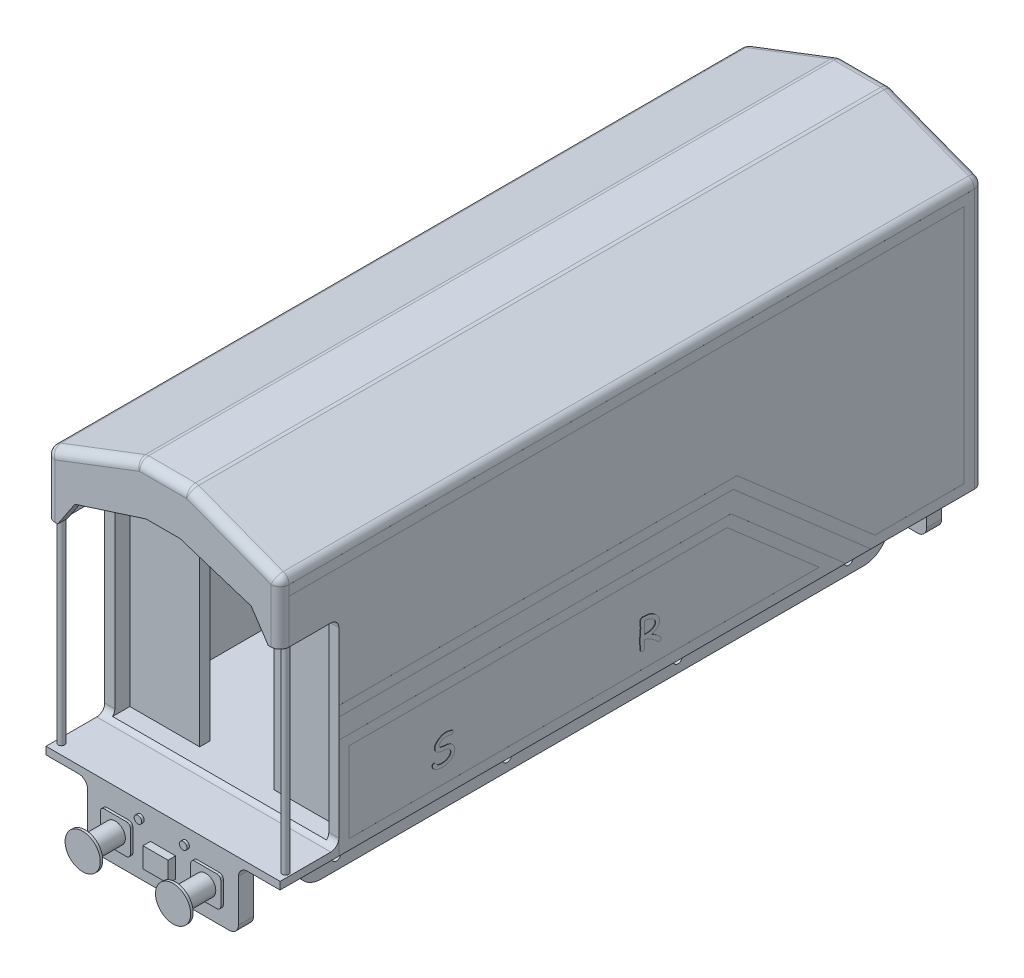
from build123d import *

# Parameters (mm, degrees)
BOSS_EXTRUDE1_DEPTH     = 14000
SHELL1_T                = 200
CUT_EXTRUDE1_DEPTH      = 3000
CUT_EXTRUDE2_REACH      = 15410.728
BOSS_EXTRUDE3_REACH     = 14774.911
SKETCH6_R               = 65
SKETCH8_W               = 3000
SKETCH8_H               = 300
BOSS_EXTRUDE4_DEPTH     = 1200
BOSS_EXTRUDE5_DEPTH     = 50
SKETCH10_R              = 200
BOSS_EXTRUDE6_DEPTH     = 500
SKETCH11_R              = 125
BOSS_EXTRUDE7_DEPTH     = 100
SKETCH12_R              = 350
BOSS_EXTRUDE8_DEPTH     = 50
SKETCH13_R              = 75
BOSS_EXTRUDE9_DEPTH     = 50
SKETCH14_W              = 500
SKETCH14_H              = 400
BOSS_EXTRUDE10_DEPTH    = 150
MIRROR4_COPY_1_DEPTH    = 50
MIRROR4_COPY_2_SKETCH_R = 200
MIRROR4_COPY_2_DEPTH    = 500
MIRROR4_COPY_3_SKETCH_R = 125
MIRROR4_COPY_3_DEPTH    = 100
MIRROR4_COPY_4_SKETCH_R = 350
MIRROR4_COPY_4_DEPTH    = 50
MIRROR4_COPY_5_SKETCH_R = 75
MIRROR4_COPY_5_DEPTH    = 50
SKETCH17_W              = 150
SKETCH17_H              = 11800
BOSS_EXTRUDE11_DEPTH    = 1000
FILLET1_R               = 500
CUT_EXTRUDE5_REACH      = 16346.553
SKETCH19_R              = 90
FILLET1_OF_MIRROR5_R    = 500
SKETCH20_W              = 200
SKETCH20_H              = 5300
BOSS_EXTRUDE12_DEPTH    = 1391
FILLET2_R               = 180
FILLET3_R               = 180
SKETCH22_W              = 4300
SKETCH22_H              = 10
EXTRUDE_THIN1_DEPTH     = 0.1
BOSS_EXTRUDE13_DEPTH    = 0.1
BOSS_EXTRUDE14_DEPTH    = 0.1
BOSS_EXTRUDE15_DEPTH    = 10
BOSS_EXTRUDE16_DEPTH    = 10


with BuildPart() as part:
    # Sketch1 → Boss-Extrude1 (new body)
    with BuildSketch(Plane.XY):
        Polygon((-2330, 0), (2330, 0), (2330, 5300), (500, 6000), (-500, 6000), (-2330, 5300), align=None)
    extrude(amount=BOSS_EXTRUDE1_DEPTH)

    # Shell1 (no face opened: a closed hollow body)
    add(offset(amount=-SHELL1_T, mode=Mode.PRIVATE), mode=Mode.SUBTRACT)

    # Sketch4 → Cut-Extrude1 (cut, symmetric)
    with BuildSketch(Plane(origin=(0, 0, 0), x_dir=(0, 0, -1), z_dir=(1, 0, 0))):
        with BuildLine():
            Line((-14390.42533688, 4100), (-12990.42533688, 4100))
            ThreePointArc((-12990.42533688, 4100), (-12877.28825189, 4053.13708499), (-12830.42533688, 3940))
            Line((-12830.42533688, 3940), (-12830.42533688, 310))
            ThreePointArc((-12830.42533688, 310), (-12877.28825189, 196.86291501), (-12990.42533688, 150))
            Line((-12990.42533688, 150), (-14390.42533688, 150))
            Line((-14390.42533688, 150), (-14390.42533688, 4100))
        make_face()
    extrude(amount=CUT_EXTRUDE1_DEPTH, both=True, mode=Mode.SUBTRACT)

    # Sketch5 → Cut-Extrude2 (cut, up to next)
    with BuildSketch(Plane.XY.offset(14000), mode=Mode.PRIVATE) as cut_extrude2_sk1:
        Polygon((-1755, 4609.835264861), (-337.194498934, 5065.001252609), (337.194498934, 5065.001252609), (1755, 4609.835264861), (2130, 4046.417851191), (-2130, 4046.417851191), align=None)
    cut_extrude2_tool1 = extrude(cut_extrude2_sk1.sketch, amount=-CUT_EXTRUDE2_REACH, mode=Mode.PRIVATE) & part.part
    add(cut_extrude2_tool1.solids().sort_by_distance((0, 4460.625012, 14000))[0], mode=Mode.SUBTRACT)

    # Sketch6 → Boss-Extrude3 (add, up to next)
    with BuildSketch(Plane.XZ.offset(-4100), mode=Mode.PRIVATE) as boss_extrude3_sk1:
        with Locations(Location((-2230, 13792.375141674, 0), (0, 0, 90))):
            Circle(SKETCH6_R)
    boss_extrude3_tool1 = extrude(boss_extrude3_sk1.sketch, amount=BOSS_EXTRUDE3_REACH, mode=Mode.PRIVATE) - part.part
    # Sketch6 → Boss-Extrude3 (add, up to next)
    with BuildSketch(Plane.XZ.offset(-4100), mode=Mode.PRIVATE) as boss_extrude3_sk2:
        with Locations(Location((2230, 13792.375141674, 0), (0, 0, 90))):
            Circle(SKETCH6_R)
    boss_extrude3_tool2 = extrude(boss_extrude3_sk2.sketch, amount=BOSS_EXTRUDE3_REACH, mode=Mode.PRIVATE) - part.part
    add(boss_extrude3_tool1.solids().sort_by_distance((-2230, 4100, 13792.375142))[0])
    add(boss_extrude3_tool2.solids().sort_by_distance((2230, 4100, 13792.375142))[0])

    # Sketch8 → Boss-Extrude4 (add)
    with BuildSketch(Plane(origin=(0, 0, 0), x_dir=(-1, 0, 0), z_dir=(0, -1, 0))):
        with Locations((0, -13850)):
            Rectangle(SKETCH8_W, SKETCH8_H)
    boss_extrude4 = extrude(amount=BOSS_EXTRUDE4_DEPTH)

    # Sketch9 → Boss-Extrude5 (add)
    with BuildSketch(Plane.XY.offset(14000)):
        with BuildLine():
            Line((1120, -300), (680, -300))
            ThreePointArc((680, -300), (623.431457505, -323.431457505), (600, -380))
            Line((600, -380), (600, -820))
            ThreePointArc((600, -820), (623.431457505, -876.568542495), (680, -900))
            Line((680, -900), (1120, -900))
            ThreePointArc((1120, -900), (1176.568542495, -876.568542495), (1200, -820))
            Line((1200, -820), (1200, -380))
            ThreePointArc((1200, -380), (1176.568542495, -323.431457505), (1120, -300))
        make_face()
    boss_extrude5 = extrude(amount=BOSS_EXTRUDE5_DEPTH)

    # Sketch10 → Boss-Extrude6 (add)
    with BuildSketch(Plane.XY.offset(14050)):
        with Locations((900, -600)):
            Circle(SKETCH10_R)
    boss_extrude6 = extrude(amount=BOSS_EXTRUDE6_DEPTH)

    # Sketch11 → Boss-Extrude7 (add)
    with BuildSketch(Plane.XY.offset(14550)):
        with Locations((900, -600)):
            Circle(SKETCH11_R)
    boss_extrude7 = extrude(amount=BOSS_EXTRUDE7_DEPTH)

    # Sketch12 → Boss-Extrude8 (add)
    with BuildSketch(Plane.XY.offset(14650)):
        with Locations((900, -600)):
            Circle(SKETCH12_R)
    boss_extrude8 = extrude(amount=BOSS_EXTRUDE8_DEPTH)

    # Mirror2: Boss-Extrude5, Boss-Extrude6, Boss-Extrude7, Boss-Extrude8 across plane
    add(boss_extrude5.mirror(Plane(origin=(0, 0, 0), x_dir=(0, 0, 1), z_dir=(1, 0, 0))))
    add(boss_extrude6.mirror(Plane(origin=(0, 0, 0), x_dir=(0, 0, 1), z_dir=(1, 0, 0))))
    add(boss_extrude7.mirror(Plane(origin=(0, 0, 0), x_dir=(0, 0, 1), z_dir=(1, 0, 0))))
    add(boss_extrude8.mirror(Plane(origin=(0, 0, 0), x_dir=(0, 0, 1), z_dir=(1, 0, 0))))

    # Sketch13 → Boss-Extrude9 (add)
    with BuildSketch(Plane.XY.offset(14000)):
        with Locations((-450, -150)):
            Circle(SKETCH13_R)
    boss_extrude9 = extrude(amount=BOSS_EXTRUDE9_DEPTH)

    # Mirror3: Boss-Extrude9 across plane
    add(boss_extrude9.mirror(Plane(origin=(0, 0, 0), x_dir=(0, 0, 1), z_dir=(1, 0, 0))))

    # Sketch14 → Boss-Extrude10 (add)
    with BuildSketch(Plane.XY.offset(14000)):
        with Locations((0, -650)):
            Rectangle(SKETCH14_W, SKETCH14_H)
    boss_extrude10 = extrude(amount=BOSS_EXTRUDE10_DEPTH)

    # Mirror4: Boss-Extrude4, Boss-Extrude5, Boss-Extrude6, Boss-Extrude7, Boss-Extrude8, Boss-Extrude9, Boss-Extrude10 across plane
    add(boss_extrude4.mirror(Plane(origin=(0, 0, 7000), x_dir=(1, 0, 0), z_dir=(0, 0, -1))))
    add(boss_extrude5.mirror(Plane(origin=(0, 0, 7000), x_dir=(1, 0, 0), z_dir=(0, 0, -1))))
    add(boss_extrude6.mirror(Plane(origin=(0, 0, 7000), x_dir=(1, 0, 0), z_dir=(0, 0, -1))))
    add(boss_extrude7.mirror(Plane(origin=(0, 0, 7000), x_dir=(1, 0, 0), z_dir=(0, 0, -1))))
    add(boss_extrude8.mirror(Plane(origin=(0, 0, 7000), x_dir=(1, 0, 0), z_dir=(0, 0, -1))))
    add(boss_extrude9.mirror(Plane(origin=(0, 0, 7000), x_dir=(1, 0, 0), z_dir=(0, 0, -1))))
    add(boss_extrude10.mirror(Plane(origin=(0, 0, 7000), x_dir=(1, 0, 0), z_dir=(0, 0, -1))))

    # Mirror4 copy 1 sketch → Mirror4 copy 1 (add)
    with BuildSketch(Plane(origin=(0, 0, 0), x_dir=(-1, 0, 0), z_dir=(0, 0, -1))):
        with BuildLine():
            Line((1120, -300), (680, -300))
            ThreePointArc((680, -300), (623.431457505, -323.431457505), (600, -380))
            Line((600, -380), (600, -820))
            ThreePointArc((600, -820), (623.431457505, -876.568542495), (680, -900))
            Line((680, -900), (1120, -900))
            ThreePointArc((1120, -900), (1176.568542495, -876.568542495), (1200, -820))
            Line((1200, -820), (1200, -380))
            ThreePointArc((1200, -380), (1176.568542495, -323.431457505), (1120, -300))
        make_face()
    extrude(amount=MIRROR4_COPY_1_DEPTH)

    # Mirror4 copy 2 sketch → Mirror4 copy 2 (add)
    with BuildSketch(Plane(origin=(0, 0, -50), x_dir=(-1, 0, 0), z_dir=(0, 0, -1))):
        with Locations((900, -600)):
            Circle(MIRROR4_COPY_2_SKETCH_R)
    extrude(amount=MIRROR4_COPY_2_DEPTH)

    # Mirror4 copy 3 sketch → Mirror4 copy 3 (add)
    with BuildSketch(Plane(origin=(0, 0, -550), x_dir=(-1, 0, 0), z_dir=(0, 0, -1))):
        with Locations((900, -600)):
            Circle(MIRROR4_COPY_3_SKETCH_R)
    extrude(amount=MIRROR4_COPY_3_DEPTH)

    # Mirror4 copy 4 sketch → Mirror4 copy 4 (add)
    with BuildSketch(Plane(origin=(0, 0, -650), x_dir=(-1, 0, 0), z_dir=(0, 0, -1))):
        with Locations((900, -600)):
            Circle(MIRROR4_COPY_4_SKETCH_R)
    extrude(amount=MIRROR4_COPY_4_DEPTH)

    # Mirror4 copy 5 sketch → Mirror4 copy 5 (add)
    with BuildSketch(Plane(origin=(0, 0, 0), x_dir=(-1, 0, 0), z_dir=(0, 0, -1))):
        with Locations((-450, -150)):
            Circle(MIRROR4_COPY_5_SKETCH_R)
    extrude(amount=MIRROR4_COPY_5_DEPTH)

    # Sketch17 → Boss-Extrude11 (add)
    with BuildSketch(Plane.XZ):
        with Locations((-1475, 7000)):
            Rectangle(SKETCH17_W, SKETCH17_H)
    boss_extrude11 = extrude(amount=BOSS_EXTRUDE11_DEPTH)

    # Fillet1
    fillet1_edges = [part.edges().sort_by_distance(p)[0] for p in [
        (-1475, -1000, 1100),
        (-1475, -1000, 12900),
    ]]
    fillet(fillet1_edges, radius=FILLET1_R)

    # Sketch19 → Cut-Extrude5 (cut, up to next)
    with BuildSketch(Plane.ZY.offset(1550), mode=Mode.PRIVATE) as cut_extrude5_sk1:
        with Locations((1900, -750)):
            Circle(SKETCH19_R)
    cut_extrude5_tool1 = extrude(cut_extrude5_sk1.sketch, amount=-CUT_EXTRUDE5_REACH, mode=Mode.PRIVATE) & part.part
    # Sketch19 → Cut-Extrude5 (cut, up to next)
    with BuildSketch(Plane.ZY.offset(1550), mode=Mode.PRIVATE) as cut_extrude5_sk2:
        with Locations((5300, -750)):
            Circle(SKETCH19_R)
    cut_extrude5_tool2 = extrude(cut_extrude5_sk2.sketch, amount=-CUT_EXTRUDE5_REACH, mode=Mode.PRIVATE) & part.part
    # Sketch19 → Cut-Extrude5 (cut, up to next)
    with BuildSketch(Plane.ZY.offset(1550), mode=Mode.PRIVATE) as cut_extrude5_sk3:
        with Locations((8700, -750)):
            Circle(SKETCH19_R)
    cut_extrude5_tool3 = extrude(cut_extrude5_sk3.sketch, amount=-CUT_EXTRUDE5_REACH, mode=Mode.PRIVATE) & part.part
    # Sketch19 → Cut-Extrude5 (cut, up to next)
    with BuildSketch(Plane.ZY.offset(1550), mode=Mode.PRIVATE) as cut_extrude5_sk4:
        with Locations((12100, -750)):
            Circle(SKETCH19_R)
    cut_extrude5_tool4 = extrude(cut_extrude5_sk4.sketch, amount=-CUT_EXTRUDE5_REACH, mode=Mode.PRIVATE) & part.part
    cut_extrude5_1 = cut_extrude5_tool1.solids().sort_by_distance((-1550, -750, 1900))[0]
    add(cut_extrude5_1, mode=Mode.SUBTRACT)
    cut_extrude5_2 = cut_extrude5_tool2.solids().sort_by_distance((-1550, -750, 5300))[0]
    add(cut_extrude5_2, mode=Mode.SUBTRACT)
    cut_extrude5_3 = cut_extrude5_tool3.solids().sort_by_distance((-1550, -750, 8700))[0]
    add(cut_extrude5_3, mode=Mode.SUBTRACT)
    cut_extrude5_4 = cut_extrude5_tool4.solids().sort_by_distance((-1550, -750, 12100))[0]
    add(cut_extrude5_4, mode=Mode.SUBTRACT)
    cut_extrude5 = cut_extrude5_1 + cut_extrude5_2 + cut_extrude5_3 + cut_extrude5_4  # Cut-Extrude5 as one shape, for the pattern or mirror that repeats it

    # Mirror5: Boss-Extrude11, Cut-Extrude5 across plane
    add(boss_extrude11.mirror(Plane(origin=(0, 0, 0), x_dir=(0, 0, 1), z_dir=(1, 0, 0))))
    add(cut_extrude5.mirror(Plane(origin=(0, 0, 0), x_dir=(0, 0, 1), z_dir=(1, 0, 0))), mode=Mode.SUBTRACT)

    # Fillet1 of Mirror5
    fillet1_of_mirror5_edges = [part.edges().sort_by_distance(p)[0] for p in [
        (1475, -1000, 1100),
        (1475, -1000, 12900),
    ]]
    fillet(fillet1_of_mirror5_edges, radius=FILLET1_OF_MIRROR5_R)

    # Sketch20 → Boss-Extrude12 (add)
    with BuildSketch(Plane.ZY.offset(-2130)):
        with Locations((12430.42533688, 2650)):
            Rectangle(SKETCH20_W, SKETCH20_H)
    boss_extrude12 = extrude(amount=BOSS_EXTRUDE12_DEPTH)

    # Mirror7: Boss-Extrude12 across plane
    add(boss_extrude12.mirror(Plane(origin=(0, 0, 0), x_dir=(0, 0, 1), z_dir=(1, 0, 0))))

    # Fillet2
    fillet2_edges = [part.edges().sort_by_distance(p)[0] for p in [
        (-1500, 0, 150),
        (1500, 0, 150),
        (1500, 0, 13850),
        (-1500, 0, 13850),
        (-1500, -1200, 13850),
        (1500, -1200, 13850),
        (1500, -1200, 150),
        (-1500, -1200, 150),
    ]]
    fillet(fillet2_edges, radius=FILLET2_R)

    # Fillet3
    fillet3_edges = [part.edges().sort_by_distance(p)[0] for p in [
        (-2330, 5300, 7000),
        (-500, 6000, 7000),
        (500, 6000, 7000),
        (2330, 5300, 7000),
        (1415, 5650, 14000),
        (0, 6000, 14000),
        (-1415, 5650, 14000),
        (2330, 4700, 14000),
        (-2330, 4700, 14000),
        (-1415, 5650, 0),
        (0, 6000, 0),
        (1415, 5650, 0),
        (2330, 2650, 0),
        (-2330, 2650, 0),
    ]]
    fillet(fillet3_edges, radius=FILLET3_R)

    # Sketch22 → Extrude-Thin1 (add)
    with BuildSketch(Plane(origin=(0, 0, 0), x_dir=(-1, 0, 0), z_dir=(0, 0, -1))):
        with Locations((0, 155)):
            Rectangle(SKETCH22_W, SKETCH22_H)
    extrude(amount=EXTRUDE_THIN1_DEPTH)

    # Sketch23 → Boss-Extrude13 (add)
    with BuildSketch(Plane(origin=(2330, 0, 0), x_dir=(0, 0, -1), z_dir=(1, 0, 0))):
        Polygon((-380, 4976.133334089), (-13620, 4976.133334089), (-13820, 4976.133334089), (-13820, 5176.133334089), (-180, 5176.133334089), (-180, 0), (-2237.013164663, 0), (-4977.742745599, 2397.302348445), (-12830.42533688, 2397.302348445), (-12830.42533688, 2597.302348445), (-12630.42533688, 2597.302348445), (-4902.615440442, 2597.302348445), (-2161.885859505, 200), (-380, 200), align=None)
    boss_extrude13 = extrude(amount=BOSS_EXTRUDE13_DEPTH)

    # Sketch25 → Boss-Extrude14 (add)
    with BuildSketch(Plane(origin=(2330, 0, 0), x_dir=(0, 0, -1), z_dir=(1, 0, 0))):
        Polygon((-12830.42533688, 310), (-12830.42533688, 0), (-2737.608532027, 0), (-5024.119937411, 2000), (-12830.42533688, 2000), align=None)
        Polygon((-12630.42533688, 310), (-12630.42533688, 200), (-3270.038118261, 200), (-5099.247242569, 1800), (-12630.42533688, 1800), align=None, mode=Mode.SUBTRACT)
    boss_extrude14 = extrude(amount=BOSS_EXTRUDE14_DEPTH)

    # Mirror8: Boss-Extrude13, Boss-Extrude14 across plane
    add(boss_extrude13.mirror(Plane(origin=(0, 0, 0), x_dir=(0, 0, 1), z_dir=(1, 0, 0))))
    add(boss_extrude14.mirror(Plane(origin=(0, 0, 0), x_dir=(0, 0, 1), z_dir=(1, 0, 0))))

    # Sketch26 → Boss-Extrude15 (add)
    # profile 1 of 2: a face of its own
    with BuildSketch(Plane(origin=(2330, 0, 0), x_dir=(0, 0, -1), z_dir=(1, 0, 0))):
        with BuildLine():
            add(Edge.make_bspline(
                [(-10976.652245452, 623.49716014), (-10976.582564331, 625.973818047), (-10976.447915308, 630.759613191), (-10974.358983832, 637.589336934), (-10970.855286796, 643.691527499), (-10965.977817614, 648.919458715), (-10960.123548487, 653.254746429), (-10953.48281225, 656.337207264), (-10946.180510287, 658.156094497), (-10941.136545206, 658.412667225), (-10938.517460753, 658.545892898)],
                knots=[0, 0, 0, 0, 1.020978776, 1.972898741, 2.919100688, 3.908607674, 4.908561358, 5.914730999, 6.917221763, 8, 8, 8, 8], degree=3))
            add(Edge.make_bspline(
                [(-10938.517460753, 658.545892898), (-10935.495322307, 658.33167808), (-10929.379747692, 657.89819473), (-10920.779895836, 653.608938256), (-10912.737607169, 647.170818121), (-10908.415475562, 641.432191274), (-10906.113915374, 638.376339141)],
                knots=[0, 0, 0, 0, 0.907817167, 1.837051385, 2.848217297, 4, 4, 4, 4], degree=3))
            add(Edge.make_bspline(
                [(-10906.113915374, 638.376339141), (-10903.076744254, 634.150440258), (-10897.389529391, 626.237288847), (-10888.740602196, 615.753907398), (-10880.611028102, 607.345088474), (-10874.901806511, 603.082557776), (-10872.277560164, 601.123283568)],
                knots=[0, 0, 0, 0, 1.23447497, 2.31159988, 3.223926103, 4, 4, 4, 4], degree=3))
            add(Edge.make_bspline(
                [(-10872.277560164, 601.123283568), (-10869.517853163, 599.480778058), (-10863.857277903, 596.111751543), (-10854.486238334, 592.133074511), (-10844.360214195, 588.531999582), (-10833.257369343, 585.870480909), (-10821.301841787, 583.664072665), (-10808.466933228, 581.988615697), (-10794.696318266, 581.16633509), (-10785.244437577, 581.026191636), (-10780.357298781, 580.953729812)],
                knots=[0, 0, 0, 0, 0.807895578, 1.657115672, 2.558318706, 3.511992341, 4.528196508, 5.619539607, 6.769171901, 8, 8, 8, 8], degree=3))
            add(Edge.make_bspline(
                [(-10780.357298781, 580.953729812), (-10775.579861745, 581.057924723), (-10766.12300485, 581.264176813), (-10752.051875508, 582.320810761), (-10738.275166814, 584.388741602), (-10724.667704022, 586.959304711), (-10711.349321691, 590.504978786), (-10698.324854435, 594.872184877), (-10685.472452313, 599.720603407), (-10677.239765239, 603.73968346), (-10673.116993834, 605.75236148)],
                knots=[0, 0, 0, 0, 1.032504842, 2.043826106, 3.046385216, 4.04124581, 5.034838662, 6.021429811, 7.009170089, 8, 8, 8, 8], degree=3))
            add(Edge.make_bspline(
                [(-10673.116993834, 605.75236148), (-10668.095700639, 608.440148269), (-10658.470129916, 613.592502617), (-10645.492552081, 622.734803027), (-10634.54555498, 632.661822537), (-10625.37838758, 643.292294209), (-10618.540543614, 654.922069356), (-10613.451607455, 667.211375563), (-10610.408204599, 680.332051681), (-10610.039661335, 689.354041784), (-10609.852929045, 693.925274077)],
                knots=[0, 0, 0, 0, 1.189786699, 2.280762261, 3.308288894, 4.272931975, 5.202800241, 6.115543574, 7.045189811, 8, 8, 8, 8], degree=3))
            add(Edge.make_bspline(
                [(-10609.852929045, 693.925274077), (-10610.033913928, 697.721870374), (-10610.389144903, 705.173700544), (-10612.864527893, 716.06799926), (-10617.104542446, 726.295678556), (-10623.070540948, 735.889685482), (-10630.637972605, 744.873720171), (-10639.905786092, 753.160497577), (-10650.808452957, 760.809534416), (-10658.88641926, 765.171185326), (-10663.087325026, 767.439439956)],
                knots=[0, 0, 0, 0, 0.949240243, 1.863136486, 2.777725302, 3.705920659, 4.677662452, 5.705515345, 6.80676479, 8, 8, 8, 8], degree=3))
            add(Edge.make_bspline(
                [(-10663.087325026, 767.439439956), (-10666.91587633, 769.34194592), (-10674.663206521, 773.191794264), (-10687.003014326, 777.827516356), (-10699.891162483, 782.057403461), (-10713.466415827, 785.59083342), (-10727.757657572, 788.330153541), (-10742.702983846, 790.345852898), (-10758.281758672, 791.996333931), (-10768.890522893, 792.375529707), (-10774.29541104, 792.568720046)],
                knots=[0, 0, 0, 0, 0.891996852, 1.805015421, 2.748548653, 3.723361584, 4.731199176, 5.784448007, 6.871234155, 8, 8, 8, 8], degree=3))
            add(Edge.make_bspline(
                [(-10774.29541104, 792.568720046), (-10779.11190665, 792.812327257), (-10788.580903692, 793.291247233), (-10802.486997087, 794.858290984), (-10815.84392127, 797.049812077), (-10828.659053718, 799.89439071), (-10840.920372722, 803.484202146), (-10852.726551705, 807.462367778), (-10863.912427298, 812.338603785), (-10870.979521471, 816.143159429), (-10874.481882979, 818.028648559)],
                knots=[0, 0, 0, 0, 1.109083175, 2.180403794, 3.216792943, 4.22137708, 5.197588291, 6.154329841, 7.085309469, 8, 8, 8, 8], degree=3))
            add(Edge.make_bspline(
                [(-10874.481882979, 818.028648559), (-10878.661282706, 820.541480061), (-10886.807925824, 825.439585725), (-10897.623725362, 834.180321223), (-10906.843052956, 843.732597893), (-10914.21012683, 854.199137822), (-10920.252075653, 865.306348603), (-10924.223859529, 877.373434978), (-10926.931805828, 890.172982833), (-10927.159013262, 899.022604731), (-10927.275414397, 903.556373778)],
                knots=[0, 0, 0, 0, 1.104423339, 2.152783505, 3.142433753, 4.103820206, 5.046408413, 5.997202751, 6.973942584, 8, 8, 8, 8], degree=3))
            add(Edge.make_bspline(
                [(-10927.275414397, 903.556373778), (-10927.031572627, 908.97521706), (-10926.54210579, 919.852533468), (-10922.887330282, 935.900451372), (-10916.930131109, 951.572693564), (-10908.606181439, 966.862734111), (-10897.691492517, 981.631604469), (-10884.809896176, 996.275482601), (-10869.284572438, 1010.31532067), (-10857.765337049, 1018.971725095), (-10851.777357985, 1023.471534911)],
                knots=[0, 0, 0, 0, 0.882315765, 1.771084206, 2.667078851, 3.607169967, 4.597299244, 5.653059042, 6.780002939, 8, 8, 8, 8], degree=3))
            add(Edge.make_bspline(
                [(-10851.777357985, 1023.471534911), (-10845.812091971, 1027.570492382), (-10834.067919377, 1035.640352785), (-10815.685387883, 1045.942044733), (-10797.25578519, 1054.814756088), (-10778.680709966, 1062.163252083), (-10759.911847522, 1067.80743733), (-10740.990184453, 1071.739884577), (-10721.940187015, 1074.312348568), (-10709.165879602, 1074.585282851), (-10702.765135695, 1074.722040358)],
                knots=[0, 0, 0, 0, 1.084105602, 2.134342923, 3.153783451, 4.147494286, 5.124611481, 6.086661538, 7.041295226, 8, 8, 8, 8], degree=3))
            add(Edge.make_bspline(
                [(-10702.765135695, 1074.722040358), (-10696.514183731, 1074.553345626), (-10683.609484507, 1074.205085906), (-10663.677389276, 1071.907696807), (-10642.640047955, 1068.014628884), (-10628.351382047, 1064.440785245), (-10620.984759261, 1062.598264876)],
                knots=[0, 0, 0, 0, 0.904920533, 1.868151822, 2.900910592, 4, 4, 4, 4], degree=3))
            add(Edge.make_bspline(
                [(-10620.984759261, 1062.598264876), (-10616.227828439, 1061.297013604), (-10607.300577418, 1058.854977512), (-10594.954723755, 1054.539021618), (-10584.452065363, 1050.023530244), (-10575.863994251, 1045.062937463), (-10569.110461288, 1039.899021874), (-10564.12814057, 1034.474465637), (-10561.135907031, 1028.515201963), (-10560.692150133, 1024.381803346), (-10560.476097991, 1022.369373504)],
                knots=[0, 0, 0, 0, 1.536451653, 2.883432639, 4.072626447, 5.093694848, 5.966289869, 6.712663879, 7.373234022, 8, 8, 8, 8], degree=3))
            add(Edge.make_bspline(
                [(-10560.476097991, 1022.369373504), (-10560.571481209, 1019.823850981), (-10560.750469463, 1015.047134055), (-10562.341541876, 1008.371359815), (-10564.802085653, 1002.606659035), (-10568.594188793, 997.908595892), (-10573.47587501, 994.342057888), (-10579.335359287, 991.769096792), (-10586.242236268, 990.400687071), (-10591.147183378, 990.188913305), (-10593.761372496, 990.076044265)],
                knots=[0, 0, 0, 0, 1.147274365, 2.152880138, 3.080677453, 3.953489691, 4.842381196, 5.785320622, 6.819642577, 8, 8, 8, 8], degree=3))
            add(Edge.make_bspline(
                [(-10593.761372496, 990.076044265), (-10596.704361049, 990.176683348), (-10603.534658447, 990.410253698), (-10615.12614838, 992.092265216), (-10629.523314336, 994.172149936), (-10645.776226566, 997.390125042), (-10662.369451282, 1000.561228965), (-10677.740553988, 1002.74771028), (-10691.056113179, 1004.130186706), (-10699.235553917, 1004.16688519), (-10702.985567977, 1004.18371028)],
                knots=[0, 0, 0, 0, 0.64035602, 1.486183851, 2.545593541, 3.806237026, 5.090462414, 6.221050272, 7.184407993, 8, 8, 8, 8], degree=3))
            add(Edge.make_bspline(
                [(-10702.985567977, 1004.18371028), (-10707.72848728, 1004.021172372), (-10717.050527739, 1003.701709852), (-10730.706351715, 1002.244294263), (-10743.82570126, 1000.063939929), (-10756.393299829, 996.983299397), (-10768.453980631, 993.023736853), (-10779.921783934, 988.132003916), (-10790.900667469, 982.551854772), (-10797.76838705, 978.156855975), (-10801.188149382, 975.968378249)],
                knots=[0, 0, 0, 0, 1.098563762, 2.159188293, 3.177307101, 4.17590561, 5.152410848, 6.113039325, 7.060393052, 8, 8, 8, 8], degree=3))
            add(Edge.make_bspline(
                [(-10801.188149382, 975.968378249), (-10804.474472936, 973.648764137), (-10810.844267545, 969.152717043), (-10819.272275723, 961.457937891), (-10826.432493208, 953.439821094), (-10832.450550602, 945.083523811), (-10836.943979858, 936.250049716), (-10840.184272951, 927.060415736), (-10842.269403682, 917.500136398), (-10842.508368332, 910.951599093), (-10842.629418303, 907.634370986)],
                knots=[0, 0, 0, 0, 1.156832391, 2.242257832, 3.2758141, 4.246901468, 5.197449485, 6.117149032, 7.046222712, 8, 8, 8, 8], degree=3))
            add(Edge.make_bspline(
                [(-10842.629418303, 907.634370986), (-10842.4521257, 905.18864236), (-10842.098485631, 900.310223171), (-10839.454604475, 893.300530686), (-10834.963327538, 886.973934334), (-10828.738164345, 881.34540482), (-10820.897479489, 876.29133019), (-10811.426257929, 871.761907857), (-10800.181634298, 867.979531594), (-10792.05647361, 865.948855587), (-10787.741780211, 864.870508376)],
                knots=[0, 0, 0, 0, 0.779947725, 1.555737587, 2.356322645, 3.236265005, 4.218915667, 5.326038242, 6.580049603, 8, 8, 8, 8], degree=3))
            add(Edge.make_bspline(
                [(-10787.741780211, 864.870508376), (-10785.835237982, 864.446097689), (-10781.675983838, 863.52021633), (-10774.747327607, 862.474207764), (-10766.662852018, 861.384315899), (-10757.366179535, 860.285211012), (-10746.894410867, 859.188004681), (-10735.245896607, 858.106887239), (-10722.393078043, 856.960167876), (-10713.420806398, 856.365165866), (-10708.716807296, 856.053217116)],
                knots=[0, 0, 0, 0, 0.588960752, 1.284858742, 2.112302552, 3.049675239, 4.108181828, 5.287978176, 6.578136203, 8, 8, 8, 8], degree=3))
            add(Edge.make_bspline(
                [(-10708.716807296, 856.053217116), (-10701.833019831, 855.424944808), (-10688.365482215, 854.195784118), (-10668.851066836, 850.60088605), (-10650.440255312, 845.905566302), (-10633.191620367, 839.869766673), (-10617.136507996, 832.42289516), (-10602.173350817, 823.845253009), (-10588.389921874, 813.898311186), (-10580.13279659, 806.283966015), (-10576.016573836, 802.488172713)],
                knots=[0, 0, 0, 0, 1.134643475, 2.219832288, 3.254399288, 4.252361306, 5.2160512, 6.156708817, 7.081109121, 8, 8, 8, 8], degree=3))
            add(Edge.make_bspline(
                [(-10576.016573836, 802.488172713), (-10572.523829006, 798.881553013), (-10565.61905698, 791.751662905), (-10556.706395418, 780.015205293), (-10549.137869477, 767.683152428), (-10542.932461288, 754.767563687), (-10538.190864526, 741.22485663), (-10534.774155265, 727.125246554), (-10532.598821731, 712.435835741), (-10532.374488597, 702.419579565), (-10532.260765959, 697.341974441)],
                knots=[0, 0, 0, 0, 1.028307477, 2.03285068, 3.013053631, 3.989779647, 4.963831607, 5.94821947, 6.959877708, 8, 8, 8, 8], degree=3))
            add(Edge.make_bspline(
                [(-10532.260765959, 697.341974441), (-10532.514126477, 690.16000402), (-10533.012930984, 676.020471776), (-10536.976163342, 655.411900519), (-10543.367615048, 635.876977927), (-10552.536239364, 617.550784422), (-10564.226659593, 600.333071357), (-10578.501948736, 584.251245784), (-10595.346843292, 569.270473886), (-10608.05796429, 560.608076486), (-10614.592223098, 556.155098144)],
                knots=[0, 0, 0, 0, 1.006906322, 1.982350743, 2.932524148, 3.882138281, 4.847028019, 5.843859457, 6.891617794, 8, 8, 8, 8], degree=3))
            add(Edge.make_bspline(
                [(-10614.592223098, 556.155098144), (-10620.603148185, 552.501266384), (-10632.639338299, 545.184886116), (-10651.644114384, 535.82210893), (-10671.421552325, 528.002045704), (-10691.885365837, 521.642207325), (-10712.992333369, 516.468306712), (-10734.863740681, 513.07766856), (-10757.417217836, 510.714412521), (-10772.70926044, 510.516041269), (-10780.467514922, 510.415399733)],
                knots=[0, 0, 0, 0, 0.96740237, 1.93711262, 2.910412234, 3.890342931, 4.88332579, 5.897071892, 6.933101885, 8, 8, 8, 8], degree=3))
            add(Edge.make_bspline(
                [(-10780.467514922, 510.415399733), (-10786.127715598, 510.50428851), (-10797.314039425, 510.679960486), (-10813.935702736, 511.955226327), (-10830.17598952, 513.852237099), (-10846.051835939, 516.797826094), (-10861.548639201, 520.39480345), (-10876.720460579, 524.810320534), (-10891.51039651, 530.092509337), (-10901.102045714, 534.242897244), (-10905.893483092, 536.316192809)],
                knots=[0, 0, 0, 0, 1.052595361, 2.080257086, 3.098952793, 4.092052013, 5.081501202, 6.056668516, 7.029223139, 8, 8, 8, 8], degree=3))
            add(Edge.make_bspline(
                [(-10905.893483092, 536.316192809), (-10911.391113746, 538.96059811), (-10921.953555287, 544.041218866), (-10936.240213502, 553.151768063), (-10948.532145535, 562.873798864), (-10958.427262664, 573.634661354), (-10966.473357245, 584.915374705), (-10972.119562846, 597.141517256), (-10975.826168744, 610.059195356), (-10976.375187078, 618.990192886), (-10976.652245452, 623.49716014)],
                knots=[0, 0, 0, 0, 1.230486047, 2.364097874, 3.413457518, 4.384300228, 5.305970186, 6.198444544, 7.090857273, 8, 8, 8, 8], degree=3))
        make_face()
    # profile 2 of 2: a face of its own
    with BuildSketch(Plane(origin=(2330, 0, 0), x_dir=(0, 0, -1), z_dir=(1, 0, 0))):
        with BuildLine():
            add(Edge.make_bspline(
                [(-6464.183010985, 524.523065749), (-6466.44047737, 524.685176386), (-6471.023252435, 525.014269474), (-6477.735403425, 527.319650405), (-6484.180271892, 531.20395048), (-6487.975794236, 534.697681107), (-6489.97358792, 536.536625091)],
                knots=[0, 0, 0, 0, 0.92759402, 1.883064472, 2.885739552, 4, 4, 4, 4], degree=3))
            add(Edge.make_bspline(
                [(-6489.97358792, 536.536625091), (-6500.078030587, 546.498336751), (-6520.034138306, 566.172553084), (-6551.498428209, 593.32305452), (-6583.896242606, 617.855409132), (-6617.076080025, 639.941215809), (-6651.108164712, 659.545125852), (-6686.026353847, 676.528762412), (-6721.74970878, 691.129963509), (-6746.238602871, 698.729489765), (-6758.46010678, 702.522133056)],
                knots=[0, 0, 0, 0, 1.06668371, 2.106682745, 3.122149944, 4.120443899, 5.101746213, 6.072804342, 7.03820772, 8, 8, 8, 8], degree=3))
            Line((-6758.46010678, 702.522133056), (-6758.46010678, 629.44883174))
            Line((-6758.46010678, 629.44883174), (-6758.46010678, 555.934665862))
            add(Edge.make_bspline(
                [(-6758.46010678, 555.934665862), (-6758.574948136, 553.312371873), (-6758.800484406, 548.162463979), (-6760.941970535, 540.779434549), (-6764.57570303, 534.136660548), (-6769.438082445, 528.343167639), (-6775.227433692, 523.418206911), (-6782.001232746, 520.004631109), (-6789.402635737, 517.78609339), (-6794.594508222, 517.576621299), (-6797.256188323, 517.469232741)],
                knots=[0, 0, 0, 0, 1.030253241, 2.023308341, 2.993791058, 3.989789173, 4.985787287, 5.962283232, 6.955338332, 8, 8, 8, 8], degree=3))
            add(Edge.make_bspline(
                [(-6797.256188323, 517.469232741), (-6799.917069638, 517.57764451), (-6805.107384012, 517.789112475), (-6812.519969308, 519.993326132), (-6819.256895411, 523.462683438), (-6825.207708774, 528.189788715), (-6830.059705848, 534.006631886), (-6833.546881213, 540.699489053), (-6835.719394428, 548.048687207), (-6835.939959703, 553.200954397), (-6836.052269866, 555.824449721)],
                knots=[0, 0, 0, 0, 1.045277453, 2.038917917, 3.015989466, 4.014672757, 5.011257971, 5.975499002, 6.969139467, 8, 8, 8, 8], degree=3))
            add(Edge.make_bspline(
                [(-6836.052269866, 555.824449721), (-6836.034250949, 558.433149224), (-6835.99617639, 563.945416237), (-6836.317376028, 572.649794383), (-6836.436725335, 582.280453518), (-6836.985898297, 592.781611643), (-6837.324890133, 604.214978776), (-6838.096813282, 616.51373471), (-6838.645258357, 629.74973829), (-6839.636172893, 643.551120862), (-6840.293422691, 657.410108904), (-6841.170091484, 670.663515064), (-6841.612326509, 683.016614425), (-6842.283478873, 694.434386755), (-6842.501985395, 704.948559384), (-6842.942269611, 714.569302825), (-6842.976262052, 723.279912102), (-6843.064389022, 728.790425882), (-6843.106102874, 731.398761931)],
                knots=[0, 0, 0, 0, 0.712445534, 1.505420618, 2.378647905, 3.342790384, 4.377117212, 5.50258648, 6.708224005, 7.995139022, 9.281467094, 10.497664906, 11.622642009, 12.657406812, 13.6211837, 14.49469921, 15.287483804, 16, 16, 16, 16], degree=3))
            add(Edge.make_bspline(
                [(-6843.106102874, 731.398761931), (-6843.082515311, 734.44832425), (-6843.032770499, 740.879675552), (-6842.677448845, 751.020971313), (-6842.120066003, 762.190268082), (-6841.340014424, 774.424713033), (-6840.347963317, 787.724849294), (-6839.129622167, 802.053093639), (-6837.69121216, 817.409883294), (-6836.053300916, 833.45900504), (-6834.405615424, 849.543949243), (-6832.980909819, 864.938769032), (-6831.76114353, 879.266781742), (-6830.765096785, 892.493084421), (-6829.980458156, 904.653831882), (-6829.430538073, 915.750019549), (-6829.071481294, 925.817664233), (-6829.021921727, 932.175573666), (-6828.998436858, 935.188406173)],
                knots=[0, 0, 0, 0, 0.71629614, 1.510627306, 2.383268869, 3.343040369, 4.390087922, 5.51592497, 6.720652734, 8.012939535, 9.305226336, 10.51854632, 11.644383367, 12.682825442, 13.633984758, 14.506626321, 15.292332674, 16, 16, 16, 16], degree=3))
            add(Edge.make_bspline(
                [(-6828.998436858, 935.188406173), (-6829.049136742, 938.752798116), (-6829.161057441, 946.621242959), (-6829.893396127, 959.555166044), (-6830.994003788, 974.7668799), (-6832.525353362, 991.508854094), (-6834.056702935, 1008.250828288), (-6835.157310597, 1023.462542145), (-6835.889649283, 1036.39646523), (-6836.001569982, 1044.264910073), (-6836.052269866, 1047.829302016)],
                knots=[0, 0, 0, 0, 0.757749544, 1.672742668, 2.753375099, 4, 5.246624901, 6.327257332, 7.242250456, 8, 8, 8, 8], degree=3))
            add(Edge.make_bspline(
                [(-6836.052269866, 1047.829302016), (-6835.899294391, 1051.25797029), (-6835.598295308, 1058.004319747), (-6833.363672777, 1067.774658427), (-6829.589298862, 1076.939666872), (-6825.903026339, 1082.347413804), (-6824.038710524, 1085.082357589)],
                knots=[0, 0, 0, 0, 1.032692214, 2.03195585, 3.004670488, 4, 4, 4, 4], degree=3))
            add(Edge.make_bspline(
                [(-6824.038710524, 1085.082357589), (-6821.578287525, 1088.070044481), (-6816.784648187, 1093.890951463), (-6807.16063537, 1099.85089283), (-6796.220131748, 1103.128361952), (-6788.572125656, 1103.002860235), (-6784.581332137, 1102.93737239)],
                knots=[0, 0, 0, 0, 1.01891203, 1.985145153, 2.948631896, 4, 4, 4, 4], degree=3))
            Line((-6784.581332137, 1102.93737239), (-6694.093880583, 1095.883539382))
            add(Edge.make_bspline(
                [(-6694.093880583, 1095.883539382), (-6685.839610955, 1094.694871781), (-6669.837566563, 1092.39047508), (-6647.04979663, 1086.861957559), (-6626.162220575, 1079.924163051), (-6613.432767791, 1073.754177242), (-6607.243561675, 1070.754259292)],
                knots=[0, 0, 0, 0, 1.100642549, 2.133747954, 3.092606825, 4, 4, 4, 4], degree=3))
            add(Edge.make_bspline(
                [(-6607.243561675, 1070.754259292), (-6601.07595838, 1067.431133462), (-6589.000010263, 1060.924571157), (-6571.781384912, 1050.39169614), (-6555.702500334, 1039.630089047), (-6540.797720457, 1028.606353143), (-6527.065804319, 1017.364927286), (-6514.565107031, 1005.789555151), (-6503.324924723, 993.842986269), (-6493.140716279, 981.744582711), (-6484.151435726, 969.355462073), (-6476.383890539, 956.651228924), (-6469.9185069, 943.597451349), (-6464.395885231, 930.356308282), (-6460.380668803, 916.732235966), (-6457.394991703, 902.884220337), (-6455.402939135, 888.771638125), (-6455.231385798, 879.242000712), (-6455.145287444, 874.459312621)],
                knots=[0, 0, 0, 0, 1.285088098, 2.516156837, 3.70133193, 4.833679489, 5.915871266, 6.955543635, 7.956797627, 8.923330369, 9.854944987, 10.762351267, 11.651551949, 12.525187581, 13.390909519, 14.252845023, 15.123146355, 16, 16, 16, 16], degree=3))
            add(Edge.make_bspline(
                [(-6455.145287444, 874.459312621), (-6455.280808482, 869.7822036), (-6455.549463062, 860.510382973), (-6458.10037656, 846.820388555), (-6462.128033794, 833.542742438), (-6468.041498222, 820.754532977), (-6475.24712025, 808.249069406), (-6484.357157902, 796.302299468), (-6494.921302735, 784.648710493), (-6503.013314917, 777.573971497), (-6507.167305876, 773.94219226)],
                knots=[0, 0, 0, 0, 0.958014663, 1.899151822, 2.844979062, 3.795592604, 4.781247835, 5.798066499, 6.869649273, 8, 8, 8, 8], degree=3))
            add(Edge.make_bspline(
                [(-6507.167305876, 773.94219226), (-6510.736101269, 771.071632177), (-6517.943318108, 765.274508303), (-6529.413253277, 757.288622479), (-6541.474980853, 749.709446375), (-6554.253297872, 742.841515416), (-6567.647221013, 736.367341755), (-6581.756883045, 730.62823967), (-6596.420539792, 725.132168568), (-6606.527431601, 722.050133247), (-6611.652207305, 720.487363997)],
                knots=[0, 0, 0, 0, 0.929713851, 1.877566122, 2.835927701, 3.820636964, 4.821600353, 5.855058901, 6.912391442, 8, 8, 8, 8], degree=3))
            add(Edge.make_bspline(
                [(-6611.652207305, 720.487363997), (-6602.175730945, 715.295212698), (-6583.680957321, 705.161945938), (-6557.133574141, 689.268155976), (-6532.499732054, 673.073126315), (-6509.564357956, 656.805718522), (-6488.651642065, 640.144036013), (-6469.506125398, 623.395318069), (-6452.189377609, 606.435419316), (-6441.811824509, 594.57603806), (-6436.739191939, 588.779075805)],
                knots=[0, 0, 0, 0, 1.177489967, 2.298049355, 3.370731458, 4.389520182, 5.361182849, 6.283175119, 7.160802, 8, 8, 8, 8], degree=3))
            add(Edge.make_bspline(
                [(-6436.739191939, 588.779075805), (-6435.24306244, 586.800786767), (-6432.357628245, 582.985460059), (-6429.154418486, 576.681927976), (-6427.378157089, 570.101638915), (-6427.078672184, 565.643275872), (-6426.929955413, 563.429363433)],
                knots=[0, 0, 0, 0, 1.072503085, 2.068428621, 3.040829592, 4, 4, 4, 4], degree=3))
            add(Edge.make_bspline(
                [(-6426.929955413, 563.429363433), (-6427.041316544, 560.878682074), (-6427.260019778, 555.869373605), (-6429.481024594, 548.628454779), (-6433.066244896, 541.955002998), (-6437.888855939, 535.941557321), (-6443.639472493, 530.935329453), (-6450.000862038, 527.165273393), (-6456.956323503, 524.99586921), (-6461.743737422, 524.682654355), (-6464.183010985, 524.523065749)],
                knots=[0, 0, 0, 0, 1.024641278, 2.012303189, 3.018298371, 4.060307688, 5.098529397, 6.072917027, 7.018116539, 8, 8, 8, 8], degree=3))
        make_face()
        with BuildLine():
            Line((-6703.682684828, 1020.826347533), (-6758.46010678, 1025.345209304))
            Line((-6758.46010678, 1025.345209304), (-6754.271893431, 980.156591597))
            add(Edge.make_bspline(
                [(-6754.271893431, 980.156591597), (-6753.870530329, 975.747984131), (-6753.10820173, 967.374500025), (-6751.979935228, 955.448665757), (-6751.618396964, 944.779151539), (-6751.473789574, 938.0907325), (-6751.406273772, 934.967973891)],
                knots=[0, 0, 0, 0, 1.172826967, 2.227607707, 3.172487062, 4, 4, 4, 4], degree=3))
            add(Edge.make_bspline(
                [(-6751.406273772, 934.967973891), (-6751.411840393, 929.677009609), (-6751.423595018, 918.504468113), (-6752.102092398, 900.836002662), (-6752.778303638, 881.319586567), (-6753.614193419, 867.697839464), (-6754.05146115, 860.572078887)],
                knots=[0, 0, 0, 0, 0.852682441, 1.800547017, 2.849429868, 4, 4, 4, 4], degree=3))
            Line((-6754.05146115, 860.572078887), (-6758.46010678, 786.286400023))
            add(Edge.make_bspline(
                [(-6758.46010678, 786.286400023), (-6756.292231331, 786.260360366), (-6751.073079562, 786.197669992), (-6742.775091977, 785.801832298), (-6734.396723991, 785.634554244), (-6729.069140271, 785.55032032), (-6726.828074385, 785.514887038)],
                knots=[0, 0, 0, 0, 0.822146546, 1.979314634, 3.149991952, 4, 4, 4, 4], degree=3))
            add(Edge.make_bspline(
                [(-6726.828074385, 785.514887038), (-6719.405635548, 785.61381443), (-6705.066774587, 785.804924946), (-6684.248207513, 786.864103954), (-6664.852763846, 788.797281591), (-6646.913544644, 791.686961619), (-6630.401712656, 795.152630751), (-6615.323668338, 799.448651591), (-6601.621293212, 804.501544051), (-6593.282969278, 808.800124467), (-6589.278330733, 810.86459941)],
                knots=[0, 0, 0, 0, 1.261455283, 2.436912221, 3.541518553, 4.572091567, 5.523601269, 6.40695542, 7.234910064, 8, 8, 8, 8], degree=3))
            add(Edge.make_bspline(
                [(-6589.278330733, 810.86459941), (-6585.935465218, 812.904604424), (-6579.184826615, 817.024224712), (-6569.658765388, 824.247855549), (-6560.373115657, 832.197322452), (-6554.694516024, 838.146616503), (-6551.804842879, 841.174038115)],
                knots=[0, 0, 0, 0, 0.970995645, 1.960844865, 2.962333636, 4, 4, 4, 4], degree=3))
            add(Edge.make_bspline(
                [(-6551.804842879, 841.174038115), (-6548.912025768, 844.442702708), (-6543.562152703, 850.487654735), (-6537.621727457, 859.858727936), (-6533.602969975, 868.421937405), (-6533.011024516, 874.058593804), (-6532.73745053, 876.663635436)],
                knots=[0, 0, 0, 0, 1.272857899, 2.353978121, 3.239273211, 4, 4, 4, 4], degree=3))
            add(Edge.make_bspline(
                [(-6532.73745053, 876.663635436), (-6532.901137387, 880.975815911), (-6533.22908733, 889.615357062), (-6536.09052369, 902.403331245), (-6540.871417044, 914.842005979), (-6547.135054707, 927.225667057), (-6555.557999175, 939.204084686), (-6565.613391551, 951.065137773), (-6577.643722118, 962.535366469), (-6586.54185106, 969.714085623), (-6591.152005126, 973.433407012)],
                knots=[0, 0, 0, 0, 0.882366302, 1.767838804, 2.667832895, 3.606679194, 4.602184672, 5.659035605, 6.787137544, 8, 8, 8, 8], degree=3))
            add(Edge.make_bspline(
                [(-6591.152005126, 973.433407012), (-6595.598251208, 976.716934758), (-6604.390281142, 983.209799458), (-6618.037753833, 991.950092922), (-6631.988417095, 999.4045412), (-6645.976380961, 1005.961719901), (-6660.150141606, 1011.403829738), (-6674.486398563, 1015.682009658), (-6688.991026601, 1018.970108181), (-6698.783292498, 1020.207326541), (-6703.682684828, 1020.826347533)],
                knots=[0, 0, 0, 0, 1.072583951, 2.120933036, 3.141837587, 4.140335143, 5.117603438, 6.085357071, 7.042041242, 8, 8, 8, 8], degree=3))
        make_face(mode=Mode.SUBTRACT)
    extrude(amount=BOSS_EXTRUDE15_DEPTH)

    # Sketch27 → Boss-Extrude16 (add)
    # profile 1 of 2: a face of its own
    with BuildSketch(Plane.ZY.offset(2330)):
        with BuildLine():
            Line((6439.923576952, 608.237005618), (6484.656816802, 635.055748941))
            add(Edge.make_bspline(
                [(6484.656816802, 635.055748941), (6488.817312196, 628.091252645), (6496.788660815, 614.747546506), (6510.086068686, 596.716866584), (6523.864496922, 581.391873836), (6538.225979495, 568.861720077), (6553.082854985, 558.996709819), (6568.532110728, 552.011372404), (6584.52168449, 547.654671366), (6595.403440833, 547.125491613), (6600.836036887, 546.861304496)],
                knots=[0, 0, 0, 0, 1.272034388, 2.437168799, 3.508375237, 4.49857839, 5.41946034, 6.295179144, 7.148887113, 8, 8, 8, 8], degree=3))
            add(Edge.make_bspline(
                [(6600.836036887, 546.861304496), (6605.475597941, 546.99052284), (6614.673538628, 547.246698511), (6628.21449679, 549.708200726), (6641.365316894, 553.489796407), (6653.85495617, 558.905580099), (6665.511078843, 565.457946393), (6675.732567305, 573.372189897), (6684.569062988, 582.232890047), (6691.797345786, 592.118124737), (6697.343017788, 602.749407919), (6701.605390036, 613.661724371), (6703.970776172, 625.026496004), (6704.327094849, 632.678315982), (6704.506910285, 636.539790073)],
                knots=[0, 0, 0, 0, 1.095163259, 2.171163733, 3.241058638, 4.321873601, 5.38011039, 6.391990106, 7.366004449, 8.327778327, 9.272591725, 10.192022065, 11.087607919, 12, 12, 12, 12], degree=3))
            add(Edge.make_bspline(
                [(6704.506910285, 636.539790073), (6704.284008548, 640.945609017), (6703.83088189, 649.901995115), (6700.001003355, 663.115990264), (6693.976176749, 676.192843112), (6688.418015141, 684.281724932), (6685.532384377, 688.48122971)],
                knots=[0, 0, 0, 0, 0.938893495, 1.908633276, 2.914225137, 4, 4, 4, 4], degree=3))
            add(Edge.make_bspline(
                [(6685.532384377, 688.48122971), (6683.163136757, 691.512118517), (6678.189197739, 697.875090443), (6669.638240478, 707.346453426), (6659.604316053, 717.116142958), (6648.430802394, 727.557214663), (6635.710680629, 738.184060115), (6621.842354046, 749.503430708), (6606.471746798, 761.084859618), (6595.691941952, 768.851902267), (6590.129740146, 772.859568385)],
                knots=[0, 0, 0, 0, 0.722233717, 1.516239348, 2.393582979, 3.351407094, 4.387010283, 5.505090956, 6.712668013, 8, 8, 8, 8], degree=3))
            add(Edge.make_bspline(
                [(6590.129740146, 772.859568385), (6584.562302628, 776.825081037), (6573.91778605, 784.406839257), (6559.0317861, 795.659082198), (6545.720301812, 805.946667235), (6534.042498123, 815.366440494), (6524.003511457, 823.919679542), (6515.52423384, 831.524248913), (6508.820666279, 838.385811091), (6505.092977298, 842.83706157), (6503.419336834, 844.83556331)],
                knots=[0, 0, 0, 0, 1.452282411, 2.77665338, 3.964542531, 5.026858415, 5.96415736, 6.766646006, 7.446254459, 8, 8, 8, 8], degree=3))
            add(Edge.make_bspline(
                [(6503.419336834, 844.83556331), (6501.080035353, 847.950243882), (6496.47948504, 854.075681238), (6490.406767547, 863.649796639), (6485.245251267, 873.450457004), (6481.199041527, 883.503998432), (6477.791779869, 893.669279346), (6475.500045106, 904.07893197), (6474.065036286, 914.686246904), (6473.91808118, 921.824478546), (6473.844517122, 925.397796216)],
                knots=[0, 0, 0, 0, 1.068054152, 2.10047183, 3.106115577, 4.101338837, 5.06977816, 6.043150881, 7.020423561, 8, 8, 8, 8], degree=3))
            add(Edge.make_bspline(
                [(6473.844517122, 925.397796216), (6474.041852292, 930.996345466), (6474.43230473, 942.073778912), (6477.734382936, 958.255821133), (6482.946356143, 973.705434212), (6490.248083237, 988.26966324), (6499.660802071, 1001.569281779), (6510.553467243, 1013.757273263), (6523.52734671, 1024.00323748), (6537.762326655, 1032.955536784), (6553.343468625, 1039.962599286), (6569.670664734, 1045.248366524), (6586.769864909, 1048.243337627), (6598.35152931, 1048.673136608), (6604.228130905, 1048.891219026)],
                knots=[0, 0, 0, 0, 1.005424448, 1.989358655, 2.955360095, 3.929531133, 4.905563448, 5.876582895, 6.856512386, 7.866279853, 8.892233794, 9.918561126, 10.94386622, 12, 12, 12, 12], degree=3))
            add(Edge.make_bspline(
                [(6604.228130905, 1048.891219026), (6610.463846069, 1048.676142772), (6622.864693297, 1048.248424749), (6641.105705651, 1044.529512276), (6658.668099678, 1038.375958327), (6672.795831383, 1031.392673133), (6683.852808414, 1024.418042423), (6692.285114427, 1018.065045181), (6700.830014725, 1010.751189476), (6709.556434919, 1002.456993937), (6718.316510811, 993.106354189), (6727.240294662, 982.763309557), (6736.348654351, 971.491068372), (6742.208171298, 963.444030758), (6745.21203849, 959.318736387)],
                knots=[0, 0, 0, 0, 1.286793592, 2.559021753, 3.825965368, 5.121522368, 5.803751409, 6.523245864, 7.299691795, 8.125521123, 9.008227632, 9.944561021, 10.946284179, 12, 12, 12, 12], degree=3))
            Line((6745.21203849, 959.318736387), (6702.280848586, 926.775834411))
            add(Edge.make_bspline(
                [(6702.280848586, 926.775834411), (6699.688546891, 930.115434034), (6694.696379929, 936.546722081), (6687.117278939, 945.553337655), (6679.973733361, 953.780591108), (6672.935756251, 960.926628322), (6666.375052446, 967.382784196), (6660.007356773, 972.910271239), (6653.92430605, 977.563248168), (6646.256392178, 982.528881638), (6636.622880003, 987.451114913), (6624.529979881, 991.616273146), (6611.892531156, 994.119240841), (6603.285313061, 994.450179795), (6598.927984003, 994.617714753)],
                knots=[0, 0, 0, 0, 1.181633172, 2.275549214, 3.290209073, 4.226197932, 5.078386478, 5.862611352, 6.581680152, 7.217281963, 8.414376989, 9.595101626, 10.782541182, 12, 12, 12, 12], degree=3))
            add(Edge.make_bspline(
                [(6598.927984003, 994.617714753), (6593.461462163, 994.43451726), (6582.919789756, 994.081238153), (6567.953408821, 990.222859424), (6554.483255865, 984.14774483), (6542.9092371, 975.633456475), (6533.27281319, 965.545877819), (6526.302106925, 953.937646159), (6522.106546332, 941.119354337), (6521.594573099, 932.177699153), (6521.333833362, 927.623857915)],
                knots=[0, 0, 0, 0, 1.14458467, 2.207223713, 3.21896685, 4.227309161, 5.202851033, 6.127160689, 7.046193047, 8, 8, 8, 8], degree=3))
            add(Edge.make_bspline(
                [(6521.333833362, 927.623857915), (6521.393270365, 924.788812945), (6521.512241562, 919.114087149), (6523.171526451, 910.730360259), (6525.30321071, 902.367812513), (6528.681203844, 894.064041061), (6533.344719986, 885.67382249), (6539.468716819, 877.052678835), (6547.18144376, 868.124622881), (6553.089515866, 862.317793751), (6556.208799975, 859.251962883)],
                knots=[0, 0, 0, 0, 0.858281714, 1.717966888, 2.583508476, 3.4729293, 4.427298488, 5.488583878, 6.674047936, 8, 8, 8, 8], degree=3))
            add(Edge.make_bspline(
                [(6556.208799975, 859.251962883), (6557.367126518, 858.218269694), (6560.11904524, 855.762451292), (6565.150048298, 851.741951718), (6571.793780887, 846.782484955), (6579.876756541, 840.64606925), (6589.548012422, 833.527800572), (6600.808611982, 825.518694924), (6613.533034208, 816.358750526), (6622.562419112, 809.954693791), (6627.336771396, 806.56850268)],
                knots=[0, 0, 0, 0, 0.420754252, 0.999615792, 1.744751191, 2.668019286, 3.750313428, 4.999500688, 6.413464383, 8, 8, 8, 8], degree=3))
            add(Edge.make_bspline(
                [(6627.336771396, 806.56850268), (6633.079879717, 802.389392367), (6644.200613003, 794.297124459), (6660.023842347, 782.139039503), (6674.37088238, 770.248245921), (6687.292104825, 758.700679133), (6698.91516122, 747.583931739), (6709.111102322, 736.764260427), (6717.983818279, 726.319179795), (6727.535914404, 712.927849899), (6737.296441879, 696.481185967), (6745.678669787, 676.330785616), (6750.964038986, 656.102056207), (6751.655208581, 642.505974978), (6751.996226524, 635.797769507)],
                knots=[0, 0, 0, 0, 1.163667725, 2.253281268, 3.268753668, 4.215851969, 5.092017293, 5.902905408, 6.650798638, 7.335211899, 8.59617414, 9.77448103, 10.901945474, 12, 12, 12, 12], degree=3))
            add(Edge.make_bspline(
                [(6751.996226524, 635.797769507), (6751.896873498, 631.053659546), (6751.700096815, 621.657567034), (6749.438149137, 607.860668505), (6746.124104523, 594.460525113), (6741.12918939, 581.622773588), (6735.032711891, 569.112553516), (6727.296862511, 557.258025716), (6718.330105414, 545.796820215), (6708.044048101, 535.03455426), (6696.788536679, 525.154831772), (6684.892311415, 516.366271287), (6672.335901102, 509.038322393), (6659.18742227, 503.05861175), (6645.443854697, 498.381758505), (6631.109820712, 494.993146148), (6616.16169223, 492.913413665), (6606.001619421, 492.697549729), (6600.836036887, 492.587800223)],
                knots=[0, 0, 0, 0, 0.983748083, 1.948392443, 2.894712957, 3.844097841, 4.80183111, 5.778335162, 6.776009319, 7.81870978, 8.863265674, 9.881300176, 10.883814829, 11.87499822, 12.874611388, 13.892143829, 14.928324115, 16, 16, 16, 16], degree=3))
            add(Edge.make_bspline(
                [(6600.836036887, 492.587800223), (6596.839264794, 492.665086012), (6588.896055833, 492.818684255), (6577.147122264, 494.176568319), (6565.635541517, 496.097761362), (6554.505763161, 499.147888608), (6543.614392592, 502.848574423), (6533.0087988, 507.40520328), (6522.683841848, 512.865780166), (6512.581659677, 519.109194604), (6502.727945186, 526.375067889), (6493.215120868, 534.837727469), (6483.731065439, 544.263774057), (6474.55570909, 554.909180661), (6465.503459892, 566.601962236), (6456.752795593, 579.451517345), (6448.122583515, 593.387855353), (6442.707625879, 603.194838552), (6439.923576952, 608.237005618)],
                knots=[0, 0, 0, 0, 0.915332311, 1.819136955, 2.706846663, 3.586547465, 4.459518054, 5.340707479, 6.227863349, 7.133153174, 8.059268498, 9.028702269, 10.047606654, 11.120612155, 12.245963614, 13.433783089, 14.680604001, 16, 16, 16, 16], degree=3))
        make_face()
    # profile 2 of 2: a face of its own
    with BuildSketch(Plane.ZY.offset(2330)):
        with BuildLine():
            Line((10320.479132507, 1035.322842958), (10426.376067603, 1035.322842958))
            add(Edge.make_bspline(
                [(10426.376067603, 1035.322842958), (10433.442881081, 1035.299319838), (10447.011945771, 1035.254152843), (10466.450999742, 1035.002305355), (10484.11414417, 1034.280468242), (10499.992143686, 1033.65928955), (10514.084706997, 1032.526579374), (10526.435047384, 1031.443957726), (10536.986282602, 1030.026749489), (10543.373452977, 1028.710572445), (10546.26539052, 1028.114643171)],
                knots=[0, 0, 0, 0, 1.410062039, 2.707475311, 3.878576406, 4.937260626, 5.877586885, 6.699081471, 7.410979367, 8, 8, 8, 8], degree=3))
            add(Edge.make_bspline(
                [(10546.26539052, 1028.114643171), (10550.136868217, 1027.158096503), (10557.797234482, 1025.265408903), (10568.826589705, 1021.264969255), (10579.336493445, 1016.635573627), (10589.283288313, 1011.198201627), (10598.617151981, 1004.91249089), (10607.434325161, 997.886953332), (10615.774817838, 990.160030555), (10623.301326211, 981.536905708), (10630.398063788, 972.490195316), (10636.383487081, 962.707603508), (10641.543085801, 952.477824942), (10645.651009204, 941.696822496), (10648.958750432, 930.469149845), (10651.291050908, 918.693105578), (10652.689742371, 906.422339107), (10652.832141961, 898.052750516), (10652.904346182, 893.808920682)],
                knots=[0, 0, 0, 0, 1.027469482, 2.033020251, 3.019912614, 3.986113645, 4.951240523, 5.91722682, 6.890402269, 7.87763091, 8.8651537, 9.85103654, 10.82876324, 11.815024772, 12.821070561, 13.842952187, 14.906261191, 16, 16, 16, 16], degree=3))
            add(Edge.make_bspline(
                [(10652.904346182, 893.808920682), (10652.682247659, 886.758137009), (10652.248875914, 873.000231864), (10648.208294763, 853.033884317), (10641.589701899, 834.408833175), (10632.469395108, 817.148529586), (10620.855021994, 801.589420109), (10606.896392863, 787.923244128), (10590.58572065, 776.487209725), (10575.40176455, 768.556845204), (10561.989022453, 763.477917353), (10550.947081115, 759.904325001), (10538.90219285, 757.143289775), (10525.969762499, 754.669793662), (10512.095971728, 752.802335102), (10497.314072916, 751.434576176), (10481.6135238, 750.579737861), (10470.827735934, 750.452434741), (10465.279145862, 750.386945522)],
                knots=[0, 0, 0, 0, 1.260483769, 2.459530307, 3.627416485, 4.787058657, 5.939039949, 7.08810263, 8.267026773, 9.491475466, 10.141966685, 10.831826277, 11.566392101, 12.351337768, 13.187381173, 14.07005841, 15.007169909, 16, 16, 16, 16], degree=3))
            Line((10465.279145862, 750.386945522), (10659.688534216, 506.156176291))
            Line((10659.688534216, 506.156176291), (10600.962906546, 506.156176291))
            Line((10600.962906546, 506.156176291), (10406.553518191, 750.386945522))
            Line((10406.553518191, 750.386945522), (10367.968448746, 750.386945522))
            Line((10367.968448746, 750.386945522), (10367.968448746, 506.156176291))
            Line((10367.968448746, 506.156176291), (10320.479132507, 506.156176291))
            Line((10320.479132507, 506.156176291), (10320.479132507, 1035.322842958))
        make_face()
        with BuildLine():
            Line((10367.968448746, 981.049338684), (10367.968448746, 804.660449795))
            Line((10367.968448746, 804.660449795), (10464.85513411, 803.918429229))
            add(Edge.make_bspline(
                [(10464.85513411, 803.918429229), (10469.378759042, 803.916427973), (10478.146832559, 803.912548969), (10490.831814024, 804.516369901), (10502.642830911, 805.20327635), (10513.534706536, 806.25395121), (10523.512306615, 807.608023959), (10532.57064409, 809.301808481), (10540.724505507, 811.275156048), (10550.234165483, 814.329449474), (10560.853260105, 819.168454617), (10572.393849872, 826.208714538), (10582.22158427, 835.063807555), (10590.524642023, 845.189556265), (10597.196591782, 856.322655792), (10601.900438092, 868.329654471), (10604.885307344, 880.907431789), (10605.237361239, 889.552217142), (10605.415029943, 893.91492362)],
                knots=[0, 0, 0, 0, 1.146690395, 2.22261258, 3.21895312, 4.145990853, 4.996080663, 5.770904154, 6.481378293, 7.121626537, 8.300444488, 9.431385265, 10.535395872, 11.636531494, 12.74115979, 13.810798291, 14.895190096, 16, 16, 16, 16], degree=3))
            add(Edge.make_bspline(
                [(10605.415029943, 893.91492362), (10605.233280683, 898.170417505), (10604.873119969, 906.603253591), (10601.932651394, 918.948849551), (10596.960090165, 930.60063844), (10590.258989908, 941.51122129), (10582.094831955, 951.415064687), (10572.521781702, 959.888860447), (10561.801591483, 966.881339035), (10551.782017447, 971.349679899), (10542.826368653, 974.089229139), (10535.050693861, 976.017083668), (10526.264791873, 977.565949804), (10516.426002297, 978.806930436), (10505.576327166, 979.873570816), (10493.660907299, 980.591994495), (10480.758798855, 981.017423949), (10471.816346163, 981.038452863), (10467.187198746, 981.049338684)],
                knots=[0, 0, 0, 0, 1.101028733, 2.181837193, 3.264309656, 4.369019818, 5.486613113, 6.575447106, 7.666700264, 8.788928104, 9.402425223, 10.0903467, 10.862060571, 11.710948788, 12.657782767, 13.684531032, 14.801375019, 16, 16, 16, 16], degree=3))
            Line((10467.187198746, 981.049338684), (10367.968448746, 981.049338684))
        make_face(mode=Mode.SUBTRACT)
    extrude(amount=BOSS_EXTRUDE16_DEPTH)


solid = part.part
